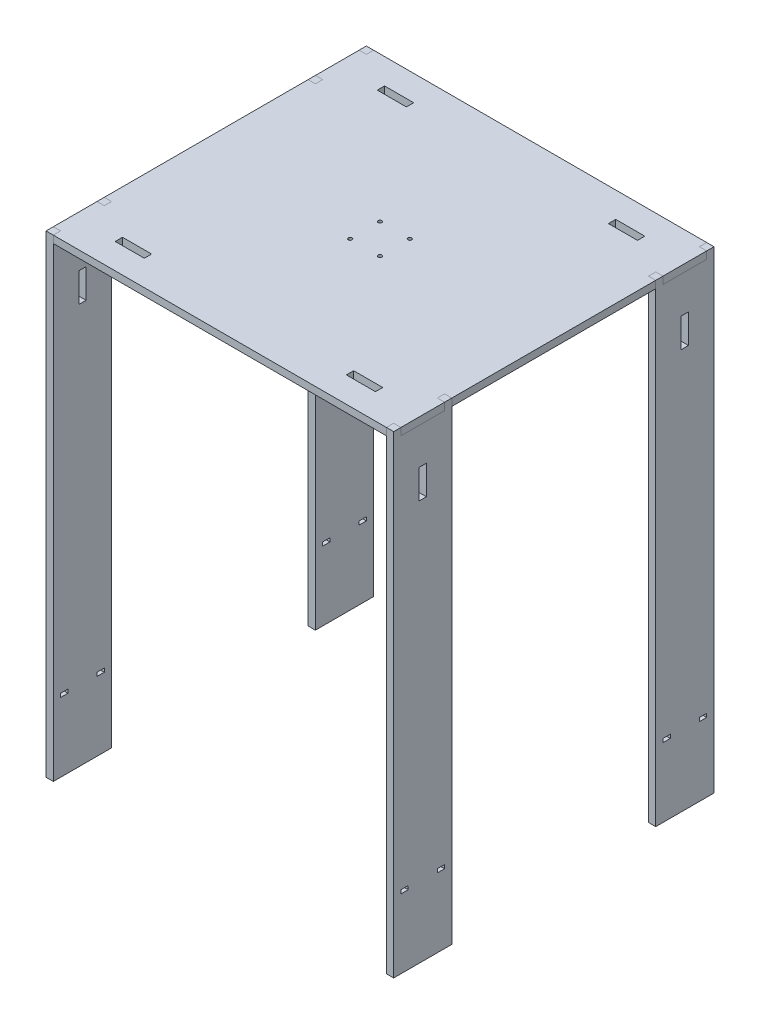
from build123d import *

# Parameters (mm, degrees)
SKETCH1_W                     = 6.35
SKETCH1_H                     = 50.8
BOSS_EXTRUDE1_DEPTH           = 412.75
BOSS_EXTRUDE1_2_DEPTH         = 412.75
SKETCH3_W                     = 38.1
SKETCH3_H                     = 6.35
SKETCH3_W_2                   = 6.35
SKETCH3_H_2                   = 3.175
CUT_EXTRUDE1_DEPTH            = 513.782159066
SKETCH4_W                     = 6.35
SKETCH4_H                     = 38.1
BOSS_EXTRUDE2_DEPTH           = 6.35
SKETCH8_W                     = 303.2125
SKETCH8_H                     = 177.8
BOSS_EXTRUDE5_DEPTH           = 6.35
SKETCH11_W                    = 1.6
SKETCH11_H                    = 412.75
M3_CLEARANCE_HOLE1_AT_2_COUNT = 2
M3_CLEARANCE_HOLE1_AT_2_PITCH = 26
M3_CLEARANCE_HOLE1_AT_3_COUNT = 2
M3_CLEARANCE_HOLE1_AT_3_PITCH = 36.769552622
M3_CLEARANCE_HOLE1_AT_4_COUNT = 2
M3_CLEARANCE_HOLE1_AT_4_PITCH = 26
SKETCH12_W                    = 25.4
SKETCH12_H                    = 6.35
CUT_EXTRUDE2_DEPTH            = 6.35
SKETCH13_W                    = 6.35
SKETCH13_H                    = 25.4
CUT_EXTRUDE3_DEPTH            = 6.35


with BuildPart() as part:
    # Sketch1 → Boss-Extrude1 (new body)
    with BuildSketch(Plane(origin=(0, 0, 0), x_dir=(1, 0, 0), z_dir=(0, 1, 0))):
        with Locations((-148.43125, 0)):
            Rectangle(SKETCH1_W, SKETCH1_H)
    extrude(amount=BOSS_EXTRUDE1_DEPTH)


with BuildPart() as body_2:
    # Sketch1 → Boss-Extrude1 2 (new body)
    with BuildSketch(Plane(origin=(0, 0, 0), x_dir=(1, 0, 0), z_dir=(0, 1, 0))):
        with Locations((148.43125, 0)):
            Rectangle(SKETCH1_W, SKETCH1_H)
    extrude(amount=BOSS_EXTRUDE1_2_DEPTH)


with BuildPart() as cut_extrude1_tool:
    # Sketch3 → Cut-Extrude1 (new, through all)
    with BuildSketch(Plane(origin=(151.60625, 0, 0), x_dir=(0, 0, -1), z_dir=(1, 0, 0))):
        with Locations((0, 409.575)):
            Rectangle(SKETCH3_W, SKETCH3_H)
        with Locations((15.875, 61.9125)):
            Rectangle(SKETCH3_W_2, SKETCH3_H_2)
        with Locations((-15.875, 61.9125)):
            Rectangle(SKETCH3_W_2, SKETCH3_H_2)
    extrude(amount=-CUT_EXTRUDE1_DEPTH)


with BuildPart() as part_1:
    add(part.part)

    # Cut-Extrude1: cut by cut_extrude1_tool
    add(cut_extrude1_tool.part, mode=Mode.SUBTRACT)


with BuildPart() as body_2_1:
    add(body_2.part)

    # Cut-Extrude1: cut by cut_extrude1_tool
    add(cut_extrude1_tool.part, mode=Mode.SUBTRACT)


with BuildPart() as body_3:
    # Sketch4 → Boss-Extrude2 (new body)
    with BuildSketch(Plane(origin=(0, 412.75, 0), x_dir=(1, 0, 0), z_dir=(0, 1, 0))):
        with Locations((-148.43125, 0)):
            Rectangle(SKETCH4_W, SKETCH4_H)
        Polygon((-145.25625, 25.4), (-145.25625, 19.05), (-145.25625, -19.05), (-145.25625, -25.4), (145.25625, -25.4), (145.25625, -19.05), (145.25625, 19.05), (145.25625, 25.4), align=None)
        with Locations((148.43125, 0)):
            Rectangle(SKETCH4_W, SKETCH4_H)
    extrude(amount=-BOSS_EXTRUDE2_DEPTH)


with BuildPart() as body_4:
    # Mirror6: mirrored copy
    add(body_3.part.mirror(Plane(origin=(0, 0, -114.3), x_dir=(1, 0, 0), z_dir=(0, 0, -1))))


    add(body_3.part)  # Boss-Extrude5 merges body 3
    # Sketch8 → Boss-Extrude5 (add)
    with BuildSketch(Plane(origin=(0, 412.75, 0), x_dir=(1, 0, 0), z_dir=(0, 1, 0))):
        with Locations((0, 114.3)):
            Rectangle(SKETCH8_W, SKETCH8_H)
    extrude(amount=-BOSS_EXTRUDE5_DEPTH)

    # Sketch11 → M3 Clearance Hole1 (revolve, cut)
    with BuildSketch(Plane(origin=(-13, 412.75, -101.3), x_dir=(0, 0, 1), z_dir=(1, 0, 0))):
        with Locations((0.8, 206.375)):
            Rectangle(SKETCH11_W, SKETCH11_H)
    m3_clearance_hole1 = revolve(axis=Axis((-13, 419.1, -101.3), (0, -1, 0)), mode=Mode.SUBTRACT)

    # M3 Clearance Hole1 at 2: M3 Clearance Hole1 ×2
    with Locations(*[(0, 0, -i * M3_CLEARANCE_HOLE1_AT_2_PITCH) for i in range(1, M3_CLEARANCE_HOLE1_AT_2_COUNT)]):
        add(m3_clearance_hole1, mode=Mode.SUBTRACT)

    # M3 Clearance Hole1 at 3: M3 Clearance Hole1 ×2
    with Locations(*[Vector(0.7071067811865476, 0, -0.7071067811865476) * (i * M3_CLEARANCE_HOLE1_AT_3_PITCH) for i in range(1, M3_CLEARANCE_HOLE1_AT_3_COUNT)]):
        add(m3_clearance_hole1, mode=Mode.SUBTRACT)

    # M3 Clearance Hole1 at 4: M3 Clearance Hole1 ×2
    with Locations(*[(i * M3_CLEARANCE_HOLE1_AT_4_PITCH, 0, 0) for i in range(1, M3_CLEARANCE_HOLE1_AT_4_COUNT)]):
        add(m3_clearance_hole1, mode=Mode.SUBTRACT)

    # Sketch12 → Cut-Extrude2 (cut)
    with BuildSketch(Plane(origin=(0, 412.75, 0), x_dir=(1, 0, 0), z_dir=(0, 1, 0))):
        with Locations((-100.80625, 0)):
            Rectangle(SKETCH12_W, SKETCH12_H)
        with Locations((100.80625, 0)):
            Rectangle(SKETCH12_W, SKETCH12_H)
        with Locations((100.80625, 228.6)):
            Rectangle(SKETCH12_W, SKETCH12_H)
        with Locations((-100.80625, 228.6)):
            Rectangle(SKETCH12_W, SKETCH12_H)
    extrude(amount=-CUT_EXTRUDE2_DEPTH, mode=Mode.SUBTRACT)


with BuildPart() as body_5:
    # Mirror6 2: mirrored copy
    add(body_2_1.part.mirror(Plane(origin=(0, 0, -114.3), x_dir=(1, 0, 0), z_dir=(0, 0, -1))))


with BuildPart() as body_6:
    # Mirror6 3: mirrored copy
    add(part_1.part.mirror(Plane(origin=(0, 0, -114.3), x_dir=(1, 0, 0), z_dir=(0, 0, -1))))


with BuildPart() as cut_extrude3_tool:
    # Sketch13 → Cut-Extrude3 (new body)
    with BuildSketch(Plane.ZY.offset(151.60625)):
        with Locations((-228.6, 361.95)):
            Rectangle(SKETCH13_W, SKETCH13_H)
        with Locations((0, 361.95)):
            Rectangle(SKETCH13_W, SKETCH13_H)
    cut_extrude3 = extrude(amount=-CUT_EXTRUDE3_DEPTH)


with BuildPart() as part_2:
    add(part_1.part)

    # Cut-Extrude3: cut by cut_extrude3_tool
    add(cut_extrude3_tool.part, mode=Mode.SUBTRACT)


with BuildPart() as body_6_1:
    add(body_6.part)

    # Cut-Extrude3: cut by cut_extrude3_tool
    add(cut_extrude3_tool.part, mode=Mode.SUBTRACT)


with BuildPart() as mirror7_tool:
    # Mirror7: Cut-Extrude3 across plane
    add(cut_extrude3.mirror(Plane(origin=(0, 0, 0), x_dir=(0, 0, 1), z_dir=(1, 0, 0))))


with BuildPart() as body_2_2:
    add(body_2_1.part)

    # Mirror7: cut by mirror7_tool
    add(mirror7_tool.part, mode=Mode.SUBTRACT)


with BuildPart() as body_5_1:
    add(body_5.part)

    # Mirror7: cut by mirror7_tool
    add(mirror7_tool.part, mode=Mode.SUBTRACT)


solid = Compound([body_4.part, part_2.part, body_6_1.part, body_2_2.part, body_5_1.part])
